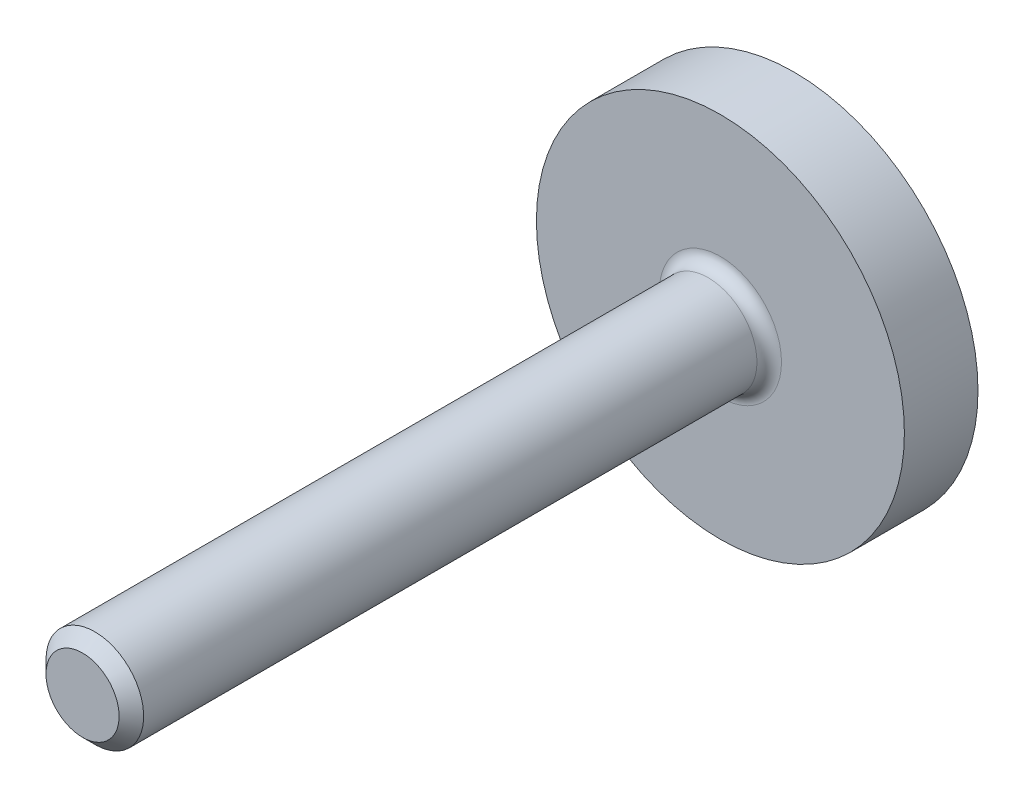
from build123d import *

# Parameters (mm, degrees)
SKETCH1_R           = 7.5
BOSS_EXTRUDE1_DEPTH = 3
SKETCH2_R           = 1.99
BOSS_EXTRUDE2_DEPTH = 26
CHAMFER1_SIZE       = 0.5
FILLET1_R           = 0.5


with BuildPart() as part:
    # Sketch1 → Boss-Extrude1 (new body)
    with BuildSketch(Plane.XY):
        Circle(SKETCH1_R)
    extrude(amount=BOSS_EXTRUDE1_DEPTH)

    # Sketch2 → Boss-Extrude2 (add)
    with BuildSketch(Plane.XY.offset(3)):
        with Locations(Location((0, 0, 0), (0, 0, 180))):
            Circle(SKETCH2_R)
    extrude(amount=BOSS_EXTRUDE2_DEPTH)

    # Chamfer1
    chamfer1_edges = [part.edges().sort_by_distance(p)[0] for p in [
        (1.99, 0, 29),
    ]]
    chamfer(chamfer1_edges, length=CHAMFER1_SIZE)

    # Fillet1
    fillet1_edges = [part.edges().sort_by_distance(p)[0] for p in [
        (1.99, 0, 3),
    ]]
    fillet(fillet1_edges, radius=FILLET1_R)


solid = part.part
